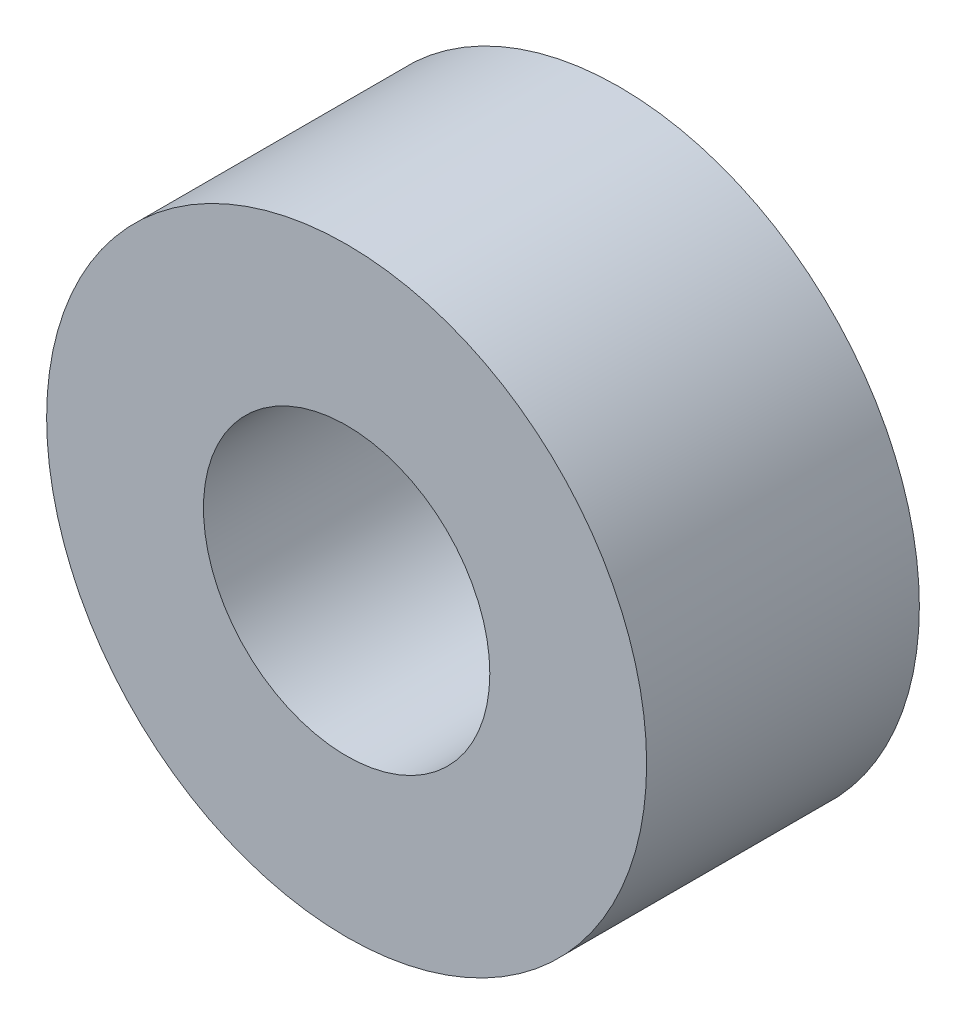
from build123d import *

# Parameters (mm, degrees)
SKIZZE1_R                       = 4.4
AUFSATZ_LINEAR_AUSTRAGEN1_DEPTH = 4
M5_GEWINDEBOHRUNG1_D            = 4.2


with BuildPart() as part:
    # Skizze1 → Aufsatz-Linear austragen1 (new body)
    with BuildSketch(Plane.XY):
        Circle(SKIZZE1_R)
    extrude(amount=AUFSATZ_LINEAR_AUSTRAGEN1_DEPTH)

    # M5 Gewindebohrung1 (through all)
    with Locations(Plane.XY.offset(4)):
        with Locations((0, 0)):
            Hole(M5_GEWINDEBOHRUNG1_D / 2)


solid = part.part
